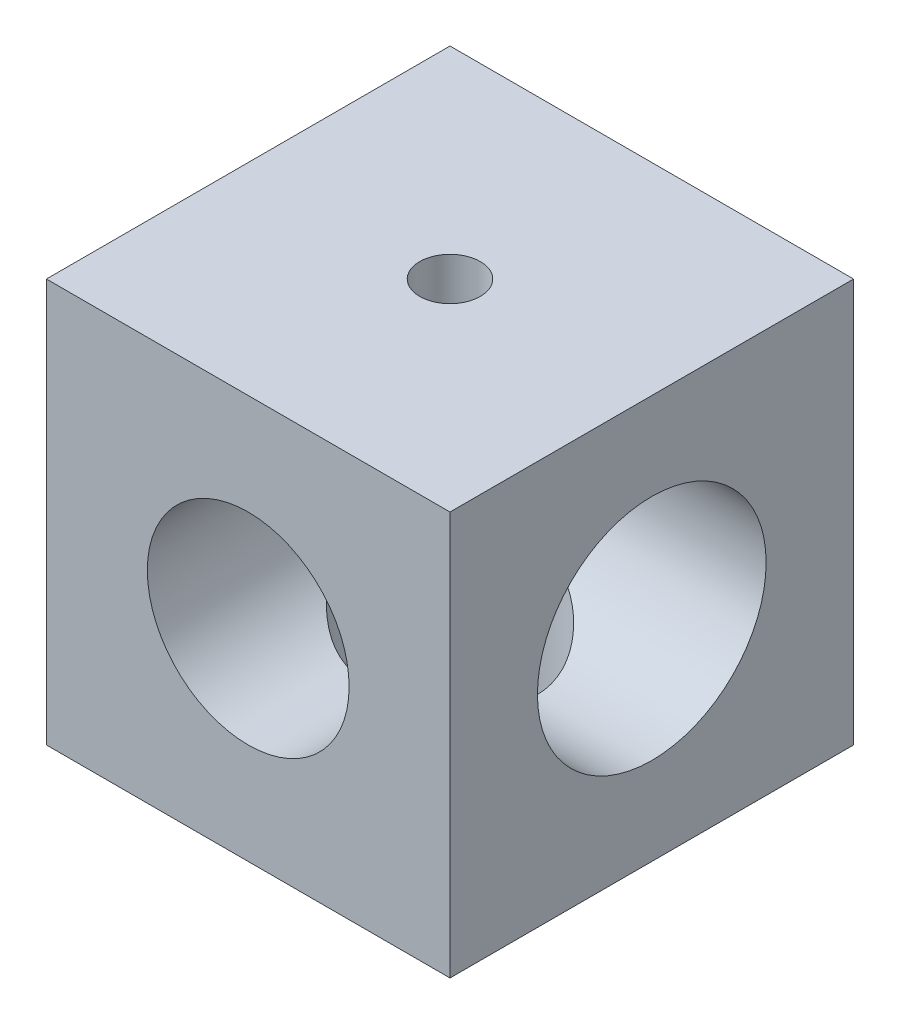
from build123d import *

# Parameters (mm, degrees)
SKETCH_1_W               = 30
SKETCH_1_H               = 30
EXTRUDE_1_DEPTH          = 30
SKETCH_2_R               = 6.5
CUT_EXTRUDE_1_DEPTH      = 15
SKETCH_3_R               = 8.5
CUT_EXTRUDE_2_DEPTH      = 15
SKETCH_4_R               = 7.5
CUT_EXTRUDE_3_DEPTH      = 15
CUT_EXTRUDE_5_DEPTH      = 37.742346223
CUT_EXTRUDE_5_DEPTH_BACK = 37.742346223
SKETCH_5_R               = 2.25
CUT_EXTRUDE_6_DEPTH      = 46.0000001
CUT_EXTRUDE_6_DEPTH_BACK = 46.0000001
SKETCH_6_R               = 2.25
CUT_EXTRUDE_7_DEPTH      = 46.0000001
CUT_EXTRUDE_7_DEPTH_BACK = 46.0000001
SKETCH_7_R               = 4.5


with BuildPart() as part:
    # 草图1 → 凸台-拉伸1 (new body)
    with BuildSketch(Plane(origin=(0, 0, 0), x_dir=(1, 0, 0), z_dir=(0, 1, 0))):
        Rectangle(SKETCH_1_W, SKETCH_1_H)
    extrude(amount=EXTRUDE_1_DEPTH)

    # 草图2 → 切除-拉伸1 (cut)
    with BuildSketch(Plane.XZ):
        with Locations(Location((0, 0, 0), (0, 0, 270))):
            Circle(SKETCH_2_R)
    extrude(amount=-CUT_EXTRUDE_1_DEPTH, mode=Mode.SUBTRACT)

    # 草图3 → 切除-拉伸2 (cut)
    with BuildSketch(Plane(origin=(15, 0, 0), x_dir=(0, 0, -1), z_dir=(1, 0, 0))):
        with Locations((0, 15)):
            Circle(SKETCH_3_R)
    extrude(amount=-CUT_EXTRUDE_2_DEPTH, mode=Mode.SUBTRACT)

    # 草图4 → 切除-拉伸3 (cut)
    with BuildSketch(Plane.XY.offset(15)):
        with Locations((0, 15)):
            Circle(SKETCH_4_R)
    extrude(amount=-CUT_EXTRUDE_3_DEPTH, mode=Mode.SUBTRACT)

    # 草图5 → 切除-拉伸5 (cut, two sides: drawn at the far end of the back side and taken through both)
    with BuildSketch(Plane.XZ.offset(-CUT_EXTRUDE_5_DEPTH_BACK)):
        with Locations(Location((0, 0, 0), (0, 0, 270))):
            Circle(SKETCH_5_R)
    extrude(amount=CUT_EXTRUDE_5_DEPTH + CUT_EXTRUDE_5_DEPTH_BACK, mode=Mode.SUBTRACT)

    # 草图6 → 切除-拉伸6 (cut, two sides: drawn at the far end of the back side and taken through both)
    with BuildSketch(Plane.XY.offset(15).offset(-CUT_EXTRUDE_6_DEPTH_BACK)):
        with Locations((0, 15)):
            Circle(SKETCH_6_R)
    extrude(amount=CUT_EXTRUDE_6_DEPTH + CUT_EXTRUDE_6_DEPTH_BACK, mode=Mode.SUBTRACT)

    # 草图7 → 切除-拉伸7 (cut, two sides: drawn at the far end of the back side and taken through both)
    with BuildSketch(Plane(origin=(15, 0, 0), x_dir=(0, 0, -1), z_dir=(1, 0, 0)).offset(-CUT_EXTRUDE_7_DEPTH_BACK)):
        with Locations((0, 15)):
            Circle(SKETCH_7_R)
    extrude(amount=CUT_EXTRUDE_7_DEPTH + CUT_EXTRUDE_7_DEPTH_BACK, mode=Mode.SUBTRACT)


solid = part.part
